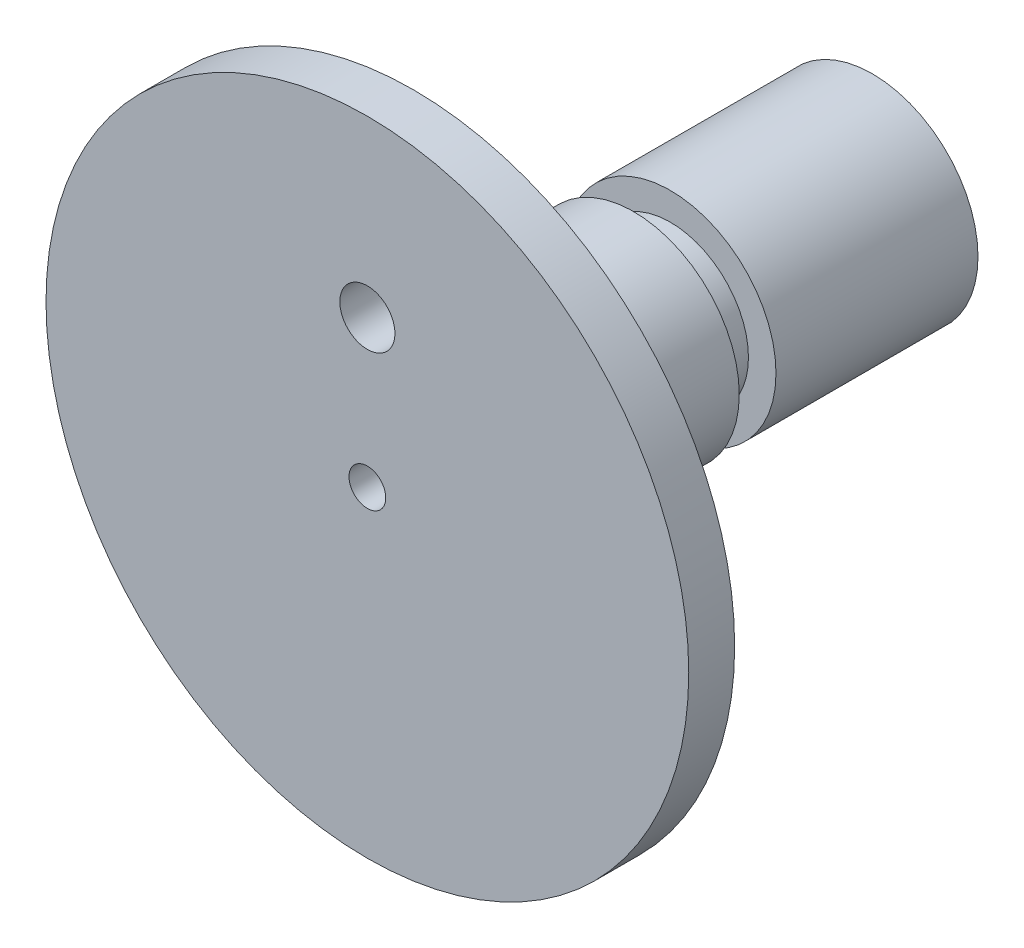
from build123d import *

# Parameters (mm, degrees)
CROQUIS2_R              = 17.5
SALIENTE_EXTRUIR1_DEPTH = 1.25
SALIENTE_EXTRUIR2_DEPTH = 25
CROQUIS4_R              = 1
CORTAR_EXTRUIR1_DEPTH   = 15
CROQUIS7_R              = 1.5
CORTAR_EXTRUIR2_DEPTH   = 10
CROQUIS8_W              = 1.5
CROQUIS8_H              = 2
CROQUIS8_W_2            = 1


with BuildPart() as part:
    # Croquis2 → Saliente-Extruir1 (new, symmetric)
    with BuildSketch(Plane.XY):
        Circle(CROQUIS2_R)
    extrude(amount=SALIENTE_EXTRUIR1_DEPTH, both=True)

    # Croquis3 → Saliente-Extruir2 (add)
    with BuildSketch(Plane(origin=(0, 0, -1.25), x_dir=(-1, 0, 0), z_dir=(0, 0, -1))):
        with BuildLine():
            ThreePointArc((5.75, 0), (4.065863992, 4.065863992), (0, 5.75))
            Line((0, 5.75), (0, 2.75))
            ThreePointArc((0, 2.75), (1.055947953, 2.53918765), (1.95, 1.939071943))
            ThreePointArc((1.95, 1.939071943), (2.542144764, 1.048808848), (2.75, 0))
            ThreePointArc((2.75, 0), (2.542144764, -1.048808848), (1.95, -1.939071943))
            ThreePointArc((1.95, -1.939071943), (1.055947953, -2.53918765), (0, -2.75))
            Line((0, -2.75), (0, -5.75))
            ThreePointArc((0, -5.75), (4.065863992, -4.065863992), (5.75, 0))
        make_face()
        with BuildLine():
            Line((0, 2.75), (0, 5.75))
            ThreePointArc((0, 5.75), (-5.75, 0), (0, -5.75))
            Line((0, -5.75), (0, -2.75))
            ThreePointArc((0, -2.75), (-1.055947953, -2.53918765), (-1.95, -1.939071943))
            ThreePointArc((-1.95, -1.939071943), (-2.75, 0), (-1.95, 1.939071943))
            ThreePointArc((-1.95, 1.939071943), (-1.055947953, 2.53918765), (0, 2.75))
        make_face()
        with BuildLine():
            Line((-1.95, -1.939071943), (-1.95, 1.939071943))
            ThreePointArc((-1.95, 1.939071943), (-2.75, 0), (-1.95, -1.939071943))
        make_face()
        with BuildLine():
            ThreePointArc((2.75, 0), (2.542144764, 1.048808848), (1.95, 1.939071943))
            Line((1.95, 1.939071943), (1.95, -1.939071943))
            ThreePointArc((1.95, -1.939071943), (2.542144764, -1.048808848), (2.75, 0))
        make_face()
    extrude(amount=SALIENTE_EXTRUIR2_DEPTH)

    # Croquis4 → Cortar-Extruir1 (cut)
    with BuildSketch(Plane.XY.offset(1.25)):
        Circle(CROQUIS4_R)
    extrude(amount=-CORTAR_EXTRUIR1_DEPTH, mode=Mode.SUBTRACT)

    # Croquis7 → Cortar-Extruir2 (cut)
    with BuildSketch(Plane.XY.offset(1.25)):
        with Locations((0, 8)):
            Circle(CROQUIS7_R)
    extrude(amount=-CORTAR_EXTRUIR2_DEPTH, mode=Mode.SUBTRACT)

    # Croquis8 → Cortar-Revolución1 (revolve, cut)
    with BuildSketch(Plane(origin=(0, 0, 0), x_dir=(1, 0, 0), z_dir=(0, 1, 0))):
        with Locations((5, 14.25)):
            Rectangle(CROQUIS8_W, CROQUIS8_H)
        with Locations((5.25, 8.25)):
            Rectangle(CROQUIS8_W_2, CROQUIS8_H)
    revolve(axis=Axis((0, 0, 0), (0, 0, -1)), mode=Mode.SUBTRACT)


solid = part.part
